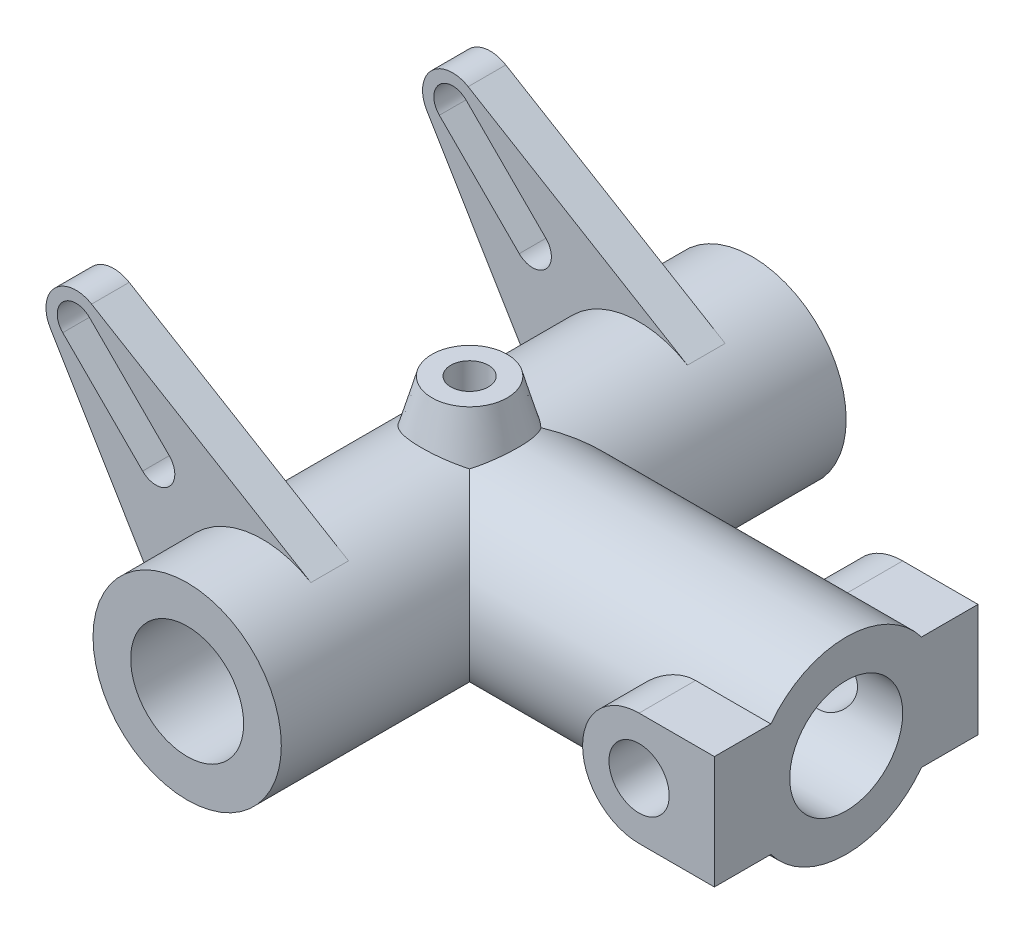
from build123d import *

# Parameters (mm, degrees)
SKETCH1_R               = 25
BOSS_EXTRUDE1_DEPTH     = 75
BOSS_EXTRUDE2_START     = 35
SKETCH3_R               = 10
BOSS_EXTRUDE2_DEPTH     = 35
BOSS_EXTRUDE2_DRAFT     = 16
SKETCH4_R               = 25
BOSS_EXTRUDE3_DEPTH     = 100
BOSS_EXTRUDE4_DEPTH     = 35
BOSS_EXTRUDE5_START     = 10
BOSS_EXTRUDE5_DEPTH     = 10
CUT_EXTRUDE2_DEPTH      = 190.22462748
CUT_EXTRUDE2_DEPTH_BACK = 190.22462748
SKETCH2_R               = 15
SKETCH7_R               = 15
CUT_EXTRUDE3_DEPTH      = 100
CUT_EXTRUDE4_DEPTH      = 160.392470452
CUT_EXTRUDE4_DEPTH_BACK = 160.392470452
SKETCH8_R               = 8
SKETCH9_R               = 5
CUT_EXTRUDE5_DEPTH      = 30


with BuildPart() as part:
    # Sketch1 → Boss-Extrude1 (new, symmetric)
    with BuildSketch(Plane.XY):
        Circle(SKETCH1_R)
    extrude(amount=BOSS_EXTRUDE1_DEPTH, both=True)


with BuildPart() as boss_extrude2_tool:
    # Sketch3 → Boss-Extrude2 (with draft: the straight prism first)
    with BuildSketch(Plane(origin=(0, 0, 0), x_dir=(1, 0, 0), z_dir=(0, 1, 0)).offset(BOSS_EXTRUDE2_START)):
        Circle(SKETCH3_R)
    extrude(amount=-BOSS_EXTRUDE2_DEPTH)
    # Boss-Extrude2: the draft: its side faces are tilted about the plane it starts from
    boss_extrude2_sides = [boss_extrude2_tool.faces().sort_by_distance(p)[0] for p in [
        (-10, 17.5, 0),
    ]]
    draft(boss_extrude2_sides, Plane(origin=(0, 0, 0), x_dir=(1, 0, 0), z_dir=(0, 1, 0)).offset(BOSS_EXTRUDE2_START), BOSS_EXTRUDE2_DRAFT)


with BuildPart() as part_1:
    add(part.part)

    # Boss-Extrude2: add boss_extrude2_tool
    add(boss_extrude2_tool.part)

    # Sketch4 → Boss-Extrude3 (add)
    with BuildSketch(Plane(origin=(0, 0, 0), x_dir=(0, 0, -1), z_dir=(1, 0, 0))):
        Circle(SKETCH4_R)
    extrude(amount=BOSS_EXTRUDE3_DEPTH)

    # Sketch5 → Boss-Extrude4 (add, symmetric)
    with BuildSketch(Plane.XY):
        with BuildLine():
            Line((80, 15), (100, 15))
            Line((100, 15), (100, -15))
            Line((100, -15), (80, -15))
            ThreePointArc((80, -15), (65, 0), (80, 15))
        make_face()
    extrude(amount=BOSS_EXTRUDE4_DEPTH, both=True)

    # Sketch6 → Boss-Extrude5 (add)
    with BuildSketch(Plane.XY.offset(45).offset(BOSS_EXTRUDE5_START)):
        with BuildLine():
            ThreePointArc((-45.383782434, 56.358781853), (-55.154328933, 55.154328933), (-56.358781853, 45.383782434))
            Line((-56.358781853, 45.383782434), (-21.441584906, -12.855288278))
            ThreePointArc((-21.441584906, -12.855288278), (-24.812182391, 3.058693344), (-17.67766953, 17.67766953))
            ThreePointArc((-17.67766953, 17.67766953), (-3.058693344, 24.812182391), (12.855288278, 21.441584906))
            Line((12.855288278, 21.441584906), (-45.383782434, 56.358781853))
        make_face()
        with BuildLine():
            ThreePointArc((-24.748737342, 31.819805153), (-23.284271247, 28.284271247), (-24.748737342, 24.748737342))
            ThreePointArc((-24.748737342, 24.748737342), (-28.284271247, 23.284271247), (-31.819805153, 24.748737342))
            Line((-31.819805153, 24.748737342), (-53.033008589, 45.961940777))
            ThreePointArc((-53.033008589, 45.961940777), (-53.033008589, 53.033008589), (-45.961940777, 53.033008589))
            Line((-45.961940777, 53.033008589), (-24.748737342, 31.819805153))
        make_face(mode=Mode.SUBTRACT)
    boss_extrude5 = extrude(amount=-BOSS_EXTRUDE5_DEPTH)

    # Mirror1: Boss-Extrude5 across plane
    add(boss_extrude5.mirror(Plane.XY))

    # Sketch2 → Cut-Extrude2 (cut, two sides: drawn at the far end of the back side and taken through both)
    with BuildSketch(Plane.XY.offset(75).offset(-CUT_EXTRUDE2_DEPTH_BACK)):
        Circle(SKETCH2_R)
    extrude(amount=CUT_EXTRUDE2_DEPTH + CUT_EXTRUDE2_DEPTH_BACK, mode=Mode.SUBTRACT)

    # Sketch7 → Cut-Extrude3 (cut)
    with BuildSketch(Plane(origin=(100, 0, 0), x_dir=(0, 0, -1), z_dir=(1, 0, 0))):
        Circle(SKETCH7_R)
    extrude(amount=-CUT_EXTRUDE3_DEPTH, mode=Mode.SUBTRACT)

    # Sketch8 → Cut-Extrude4 (cut, two sides: drawn at the far end of the back side and taken through both)
    with BuildSketch(Plane.XY.offset(35).offset(-CUT_EXTRUDE4_DEPTH_BACK)):
        with Locations((80, 0)):
            Circle(SKETCH8_R)
    extrude(amount=CUT_EXTRUDE4_DEPTH + CUT_EXTRUDE4_DEPTH_BACK, mode=Mode.SUBTRACT)

    # Sketch9 → Cut-Extrude5 (cut)
    with BuildSketch(Plane(origin=(0, 35, 0), x_dir=(1, 0, 0), z_dir=(0, 1, 0))):
        with Locations(Location((0, 0, 0), (0, 0, 270))):
            Circle(SKETCH9_R)
    extrude(amount=-CUT_EXTRUDE5_DEPTH, mode=Mode.SUBTRACT)


solid = part_1.part
